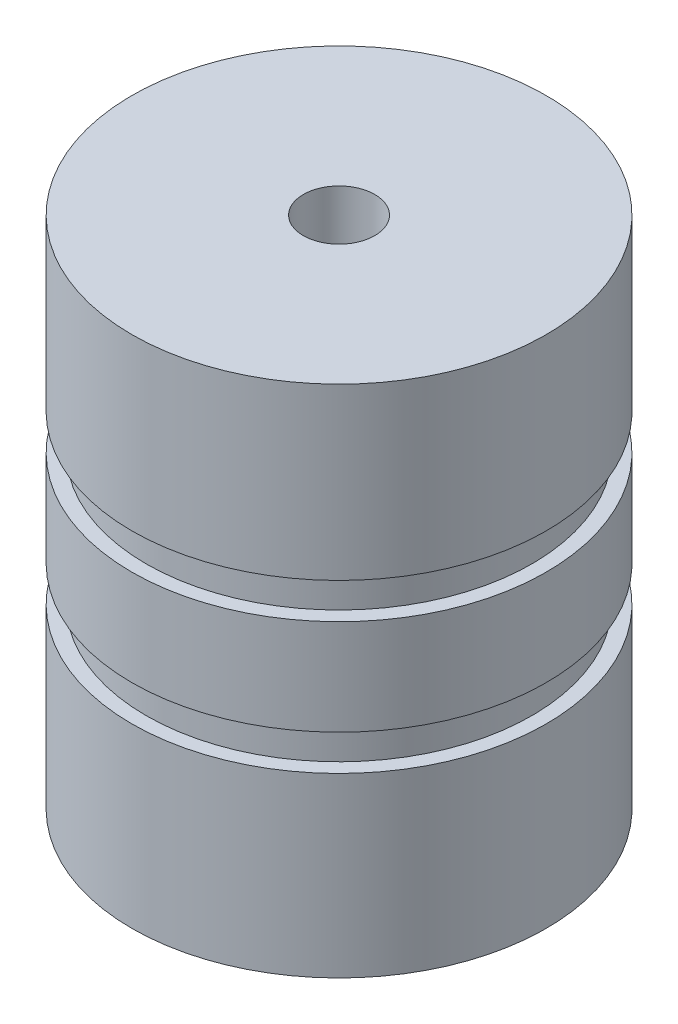
from build123d import *

# Parameters (mm, degrees)
SKETCH_1_R          = 14.5
EXTRUDE_1_DEPTH     = 18
SKETCH_2_W          = 1
SKETCH_2_H          = 2.5
SKETCH_3_R          = 7.5
CUT_EXTRUDE_1_DEPTH = 5.85
SKETCH_4_R          = 2.5
CUT_EXTRUDE_2_DEPTH = 18
SKETCH_5_R          = 4
CUT_EXTRUDE_3_DEPTH = 18


with BuildPart() as part:
    # 草图1 → 凸台-拉伸1 (new, symmetric)
    with BuildSketch(Plane(origin=(0, 0, 0), x_dir=(1, 0, 0), z_dir=(0, 1, 0))):
        with Locations(Location((0, 0, 0), (0, 0, 270))):
            Circle(SKETCH_1_R)
    extrude(amount=EXTRUDE_1_DEPTH, both=True)

    # 草图2 → 切除-旋转1 (revolve, cut)
    with BuildSketch(Plane(origin=(0, 0, 0), x_dir=(0, 0, -1), z_dir=(1, 0, 0)), mode=Mode.PRIVATE) as cut_revolve_1_sk:
        with Locations((14, -4.35)):
            Rectangle(SKETCH_2_W, SKETCH_2_H)
        with Locations((14, 4.85)):
            Rectangle(SKETCH_2_W, SKETCH_2_H)
    revolve(cut_revolve_1_sk.sketch.rotate(Axis((0, 24.456426369, 0), (0, -1, 0)), 180), axis=Axis((0, 24.456426369, 0), (0, -1, 0)), mode=Mode.SUBTRACT)

    # 草图3 → 切除-拉伸1 (cut, symmetric)
    with BuildSketch(Plane(origin=(0, 0, 0), x_dir=(1, 0, 0), z_dir=(0, 1, 0))):
        with Locations(Location((0, 0, 0), (0, 0, 270))):
            Circle(SKETCH_3_R)
    extrude(amount=CUT_EXTRUDE_1_DEPTH, both=True, mode=Mode.SUBTRACT)

    # 草图4 → 切除-拉伸2 (cut)
    with BuildSketch(Plane(origin=(0, 0, 0), x_dir=(1, 0, 0), z_dir=(0, 1, 0))):
        with Locations(Location((0, 0, 0), (0, 0, 90))):
            Circle(SKETCH_4_R)
    extrude(amount=CUT_EXTRUDE_2_DEPTH, mode=Mode.SUBTRACT)

    # 草图5 → 切除-拉伸3 (cut)
    with BuildSketch(Plane(origin=(0, 0, 0), x_dir=(1, 0, 0), z_dir=(0, 1, 0))):
        with Locations(Location((0, 0, 0), (0, 0, 270))):
            Circle(SKETCH_5_R)
    extrude(amount=-CUT_EXTRUDE_3_DEPTH, mode=Mode.SUBTRACT)


solid = part.part
